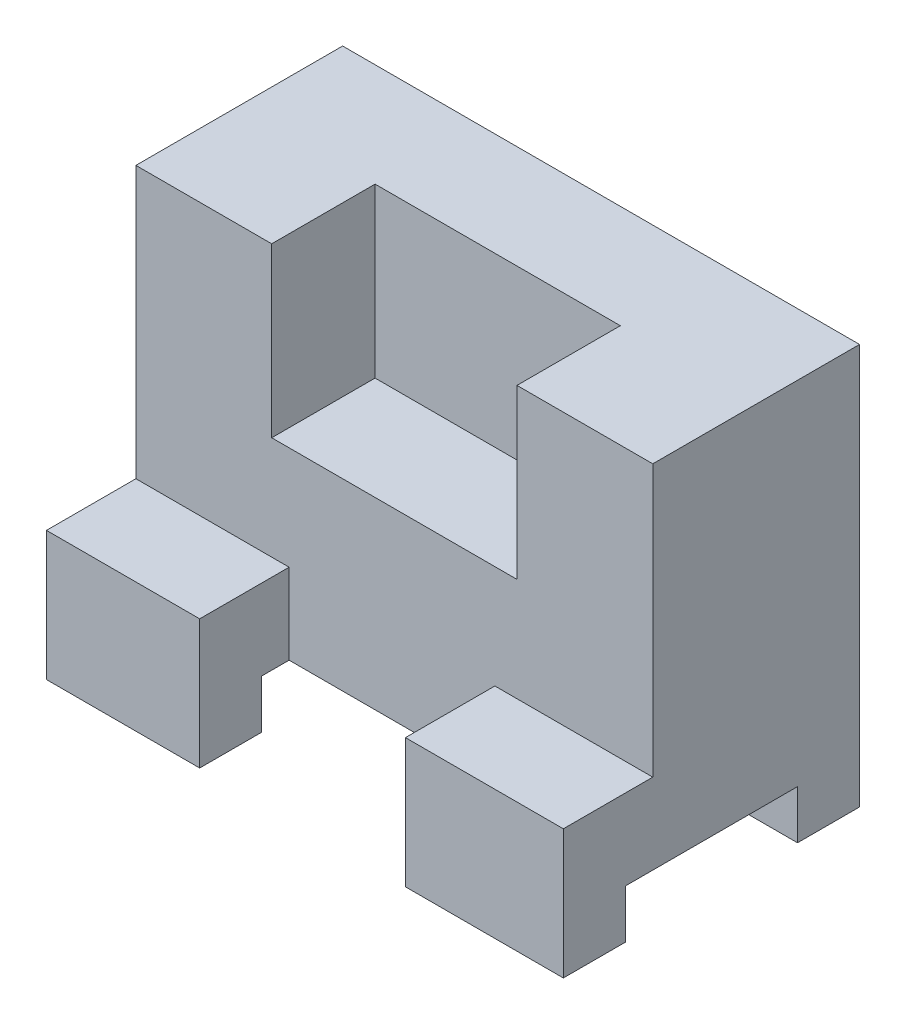
from build123d import *

# Parameters (mm, degrees)
SKETCH1_W               = 254
SKETCH1_H               = 165.1
BOSS_EXTRUDE1_DEPTH     = 101.6
SKETCH2_W               = 120.519823472
SKETCH2_H               = 82.55
CUT_EXTRUDE1_DEPTH      = 50.8
BOSS_EXTRUDE2_DEPTH     = 31.75
CUT_EXTRUDE2_DEPTH      = 315.266796717
CUT_EXTRUDE2_DEPTH_BACK = 315.266796717
SKETCH4_W               = 84.584252786
SKETCH4_H               = 23.924522196


with BuildPart() as part:
    # Sketch1 → Boss-Extrude1 (new body)
    with BuildSketch(Plane.XY):
        Rectangle(SKETCH1_W, SKETCH1_H)
    extrude(amount=BOSS_EXTRUDE1_DEPTH)

    # Sketch2 → Cut-Extrude1 (cut)
    with BuildSketch(Plane.XY.offset(101.6)):
        with Locations((0, 41.275)):
            Rectangle(SKETCH2_W, SKETCH2_H)
    extrude(amount=-CUT_EXTRUDE1_DEPTH, mode=Mode.SUBTRACT)

    # Sketch3 → Boss-Extrude2 (add, symmetric)
    with BuildSketch(Plane(origin=(0, -82.55, 0), x_dir=(-1, 0, 0), z_dir=(0, -1, 0))):
        Polygon((-127, -101.6), (-127, -145.544252786), (-49.406360538, -145.543564589), (-49.406360538, -101.6), (51.702787408, -101.6), (51.702787408, -145.542667829), (127, -145.542), (127, -101.6), (127, 0), (-127, 0), align=None)
    extrude(amount=BOSS_EXTRUDE2_DEPTH, both=True)

    # Sketch4 → Cut-Extrude2 (cut, two sides: drawn at the far end of the back side and taken through both)
    with BuildSketch(Plane(origin=(127, 0, 0), x_dir=(0, 0, -1), z_dir=(1, 0, 0)).offset(-CUT_EXTRUDE2_DEPTH_BACK)):
        with Locations((-72.772126393, -102.337738902)):
            Rectangle(SKETCH4_W, SKETCH4_H)
    extrude(amount=CUT_EXTRUDE2_DEPTH + CUT_EXTRUDE2_DEPTH_BACK, mode=Mode.SUBTRACT)


solid = part.part
